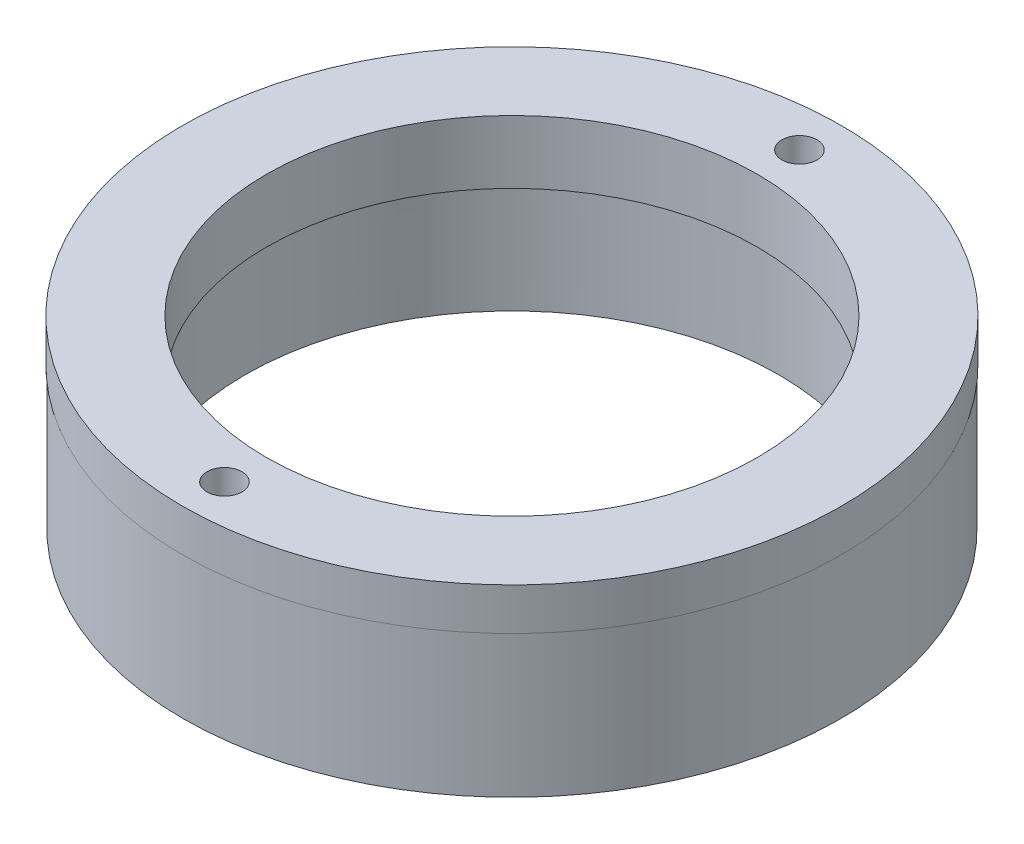
from build123d import *

# Parameters (mm, degrees)
SKETCH1_R         = 11.9126
SHAFT_DEPTH       = 6.6802
SKETCH4_R         = 11.938
CAP_DEPTH         = 1.524
SKETCH7_R         = 8.89
TOP_HOLE_DEPTH    = 2.286
SKETCH8_R         = 9.6647
BOTTOM_HOLE_DEPTH = 18.445362755
DRAFT1_ANGLE      = 0.25
SKETCH9_R         = 0.635
SIDE_HOLES_DEPTH  = 1.524


with BuildPart() as part:
    # Sketch1 → Shaft (new body)
    with BuildSketch(Plane(origin=(0, 0, 0), x_dir=(1, 0, 0), z_dir=(0, 1, 0))):
        Circle(SKETCH1_R)
    extrude(amount=-SHAFT_DEPTH)

    # Sketch4 → Cap (add)
    with BuildSketch(Plane(origin=(0, 0, 0), x_dir=(-1, 0, 0), z_dir=(0, 1, 0))):
        Circle(SKETCH4_R)
    extrude(amount=-CAP_DEPTH)

    # Sketch7 → Top Hole (cut)
    with BuildSketch(Plane(origin=(0, 0, 0), x_dir=(-1, 0, 0), z_dir=(0, 1, 0))):
        Circle(SKETCH7_R)
    extrude(amount=-TOP_HOLE_DEPTH, mode=Mode.SUBTRACT)

    # Sketch8 → Bottom Hole (cut, through all)
    with BuildSketch(Plane(origin=(0, -2.286, 0), x_dir=(-1, 0, 0), z_dir=(0, 1, 0))):
        Circle(SKETCH8_R)
    extrude(amount=-BOTTOM_HOLE_DEPTH, mode=Mode.SUBTRACT)

    # Draft1
    draft1_faces = [part.faces().sort_by_distance(p)[0] for p in [
        (9.6647, -4.4831, 0),
    ]]
    draft(draft1_faces, Plane(origin=(0, -6.6802, 0), x_dir=(0, 0, -1), z_dir=(0, -1, 0)), DRAFT1_ANGLE)

    # Sketch9 → Side Holes (cut)
    with BuildSketch(Plane(origin=(0, 0, 0), x_dir=(-1, 0, 0), z_dir=(0, 1, 0))):
        with Locations((0, -10.414)):
            Circle(SKETCH9_R)
        with Locations((0, 10.414)):
            Circle(SKETCH9_R)
    extrude(amount=-SIDE_HOLES_DEPTH, mode=Mode.SUBTRACT)


solid = part.part
